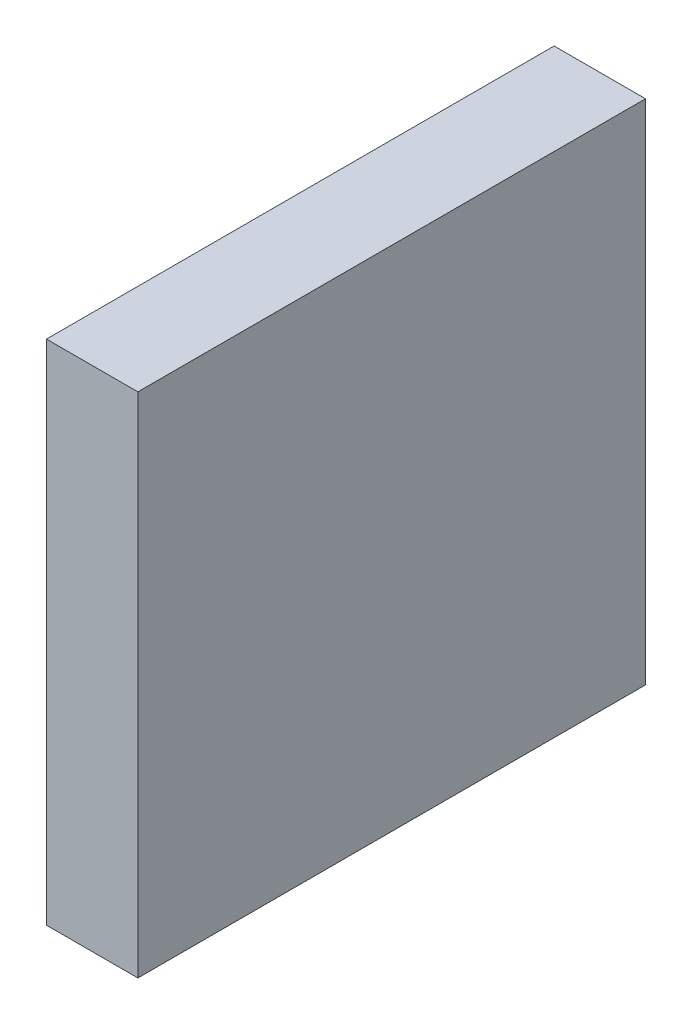
from build123d import *

# Parameters (mm, degrees)
SKETCH1_W           = 25
SKETCH1_H           = 25
BOSS_EXTRUDE1_DEPTH = 4.5


with BuildPart() as part:
    # Sketch1 → Boss-Extrude1 (new body)
    with BuildSketch(Plane(origin=(0, 0, 0), x_dir=(0, 0, -1), z_dir=(1, 0, 0))):
        Rectangle(SKETCH1_W, SKETCH1_H)
    extrude(amount=BOSS_EXTRUDE1_DEPTH)


solid = part.part
